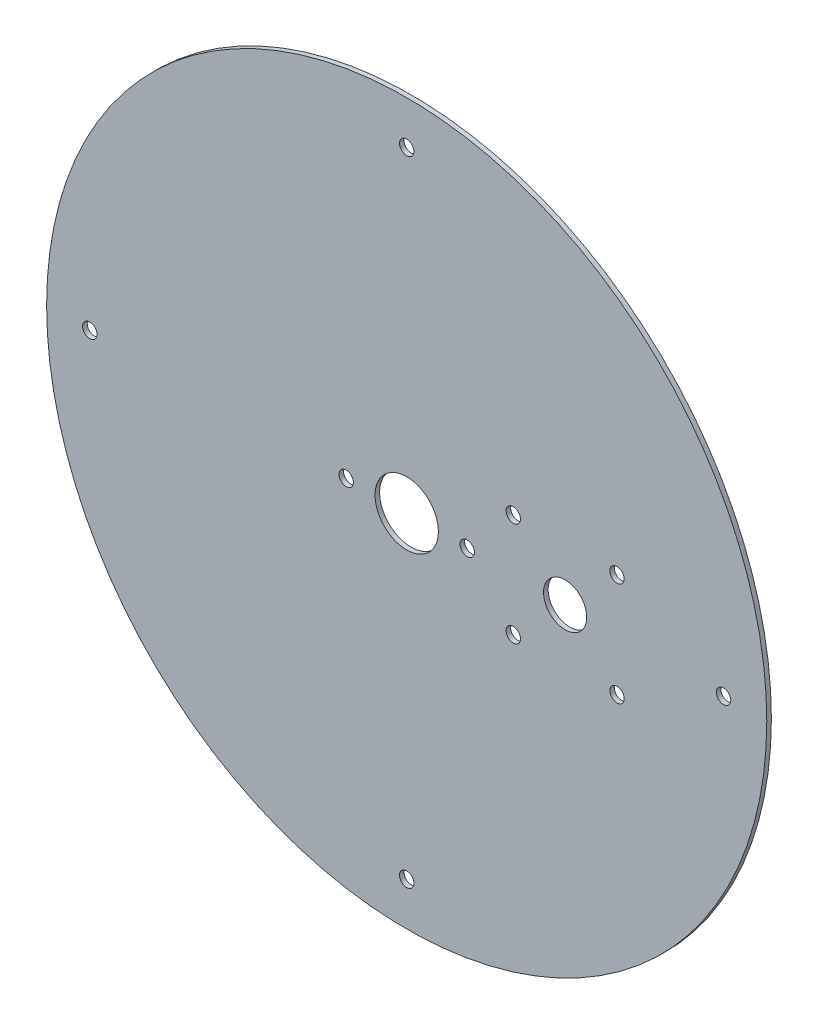
from build123d import *

# Parameters (mm, degrees)
SKETCH_1_R          = 125
EXTRUDE_1_DEPTH     = 1.6
SKETCH_2_R          = 11
CUT_EXTRUDE_1_DEPTH = 177.783935922
SKETCH_3_R          = 7.5
CUT_EXTRUDE_2_DEPTH = 177.783935922
M6X1_0_1_D          = 5
M6X1_0_2_D          = 5
M6X1_0_3_D          = 5
M6X1_0_4_D          = 5
M6X1_0_5_D          = 5
M6X1_0_6_D          = 5


with BuildPart() as part:
    # ｽｹｯﾁ1 → ﾎﾞｽ - 押し出し1 (new body)
    with BuildSketch(Plane.XY):
        Circle(SKETCH_1_R)
    extrude(amount=EXTRUDE_1_DEPTH)

    # ｽｹｯﾁ2 → ｶｯﾄ - 押し出し1 (cut, through all)
    with BuildSketch(Plane.XY.offset(1.6)):
        Circle(SKETCH_2_R)
    extrude(amount=-CUT_EXTRUDE_1_DEPTH, mode=Mode.SUBTRACT)

    # ｽｹｯﾁ3 → ｶｯﾄ - 押し出し2 (cut, through all)
    with BuildSketch(Plane.XY.offset(1.6)):
        with Locations((55, 0)):
            Circle(SKETCH_3_R)
    extrude(amount=-CUT_EXTRUDE_2_DEPTH, mode=Mode.SUBTRACT)

    # M6x1.0 ねじ穴1 (through all)
    with Locations(Plane(origin=(110, 0, 1.6), x_dir=(1, 0, 0), z_dir=(0, 0, 1))):
        with Locations((0, 0)):
            Hole(M6X1_0_1_D / 2)

    # M6x1.0 ねじ穴2 (through all)
    with Locations(Plane(origin=(-110, 0, 1.6), x_dir=(1, 0, 0), z_dir=(0, 0, 1))):
        with Locations((0, 0)):
            Hole(M6X1_0_2_D / 2)

    # M6x1.0 ねじ穴3 (through all)
    with Locations(Plane(origin=(-21, 0, 1.6), x_dir=(1, 0, 0), z_dir=(0, 0, 1))):
        with Locations((0, 0)):
            Hole(M6X1_0_3_D / 2)

    # M6x1.0 ねじ穴4 (through all)
    with Locations(Plane(origin=(21, 0, 1.6), x_dir=(1, 0, 0), z_dir=(0, 0, 1))):
        with Locations((0, 0)):
            Hole(M6X1_0_4_D / 2)

    # M6x1.0 ねじ穴5 (through all)
    with Locations(Plane(origin=(37, 18, 1.6), x_dir=(1, 0, 0), z_dir=(0, 0, 1))):
        with Locations((0, 0), (36, 0), (36, -36), (0, -36)):
            Hole(M6X1_0_5_D / 2)

    # M6x1.0 ねじ穴6 (through all)
    with Locations(Plane(origin=(0, 110, 1.6), x_dir=(1, 0, 0), z_dir=(0, 0, 1))):
        with Locations((0, 0), (0, -220)):
            Hole(M6X1_0_6_D / 2)


solid = part.part
